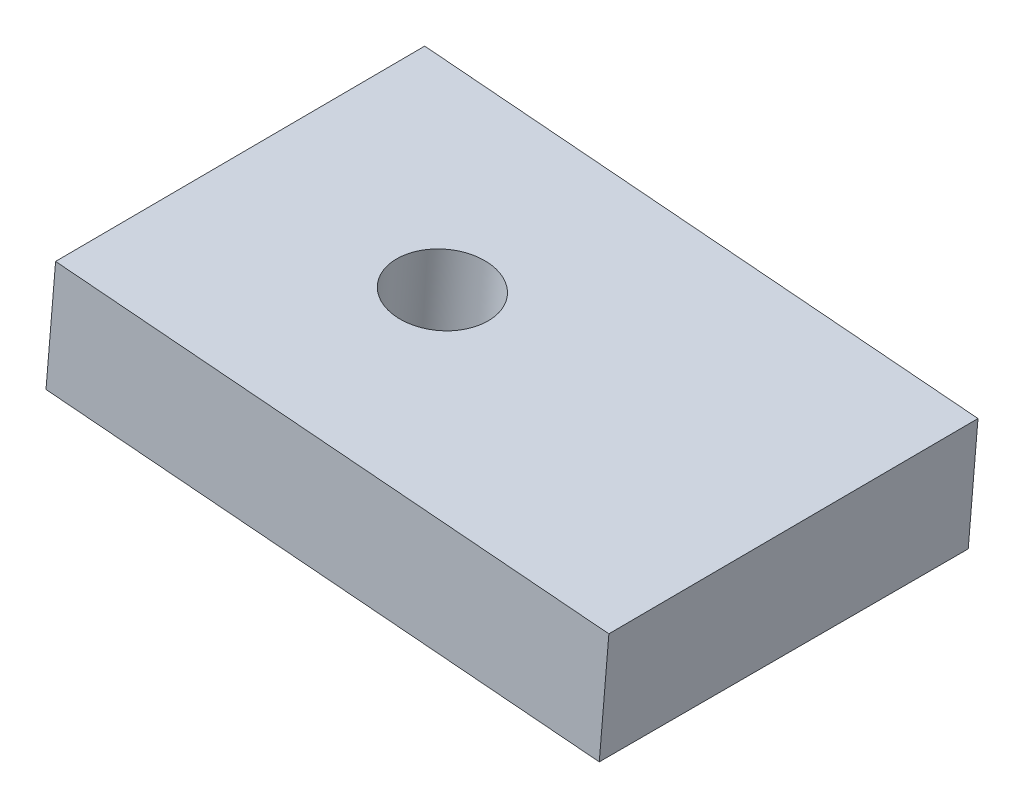
from build123d import *

# Parameters (mm, degrees)
SKETCH1_W             = 15.047570974
SKETCH1_H             = 10
BOSS_EXTRUDE1_DEPTH   = 3.146960609
DRAFT1_ANGLE          = 0.325763712
M3X0_5_TAPPED_HOLE1_D = 2.5


with BuildPart() as part:
    # Sketch1 → Boss-Extrude1 (new body)
    with BuildSketch(Plane(origin=(-1.315367261, -15.86205167, 0), x_dir=(0.9965793195216838, -0.08264175640496577, 0), z_dir=(-0.08264175640496577, -0.9965793195216838, 0))):
        with Locations((-16.701480395, 5)):
            Rectangle(SKETCH1_W, SKETCH1_H)
    extrude(amount=-BOSS_EXTRUDE1_DEPTH)

    # Draft1
    draft1_faces = [part.faces().sort_by_distance(p)[0] for p in [
        (-17.699646876, -11.345616133, 5),
    ]]
    draft(draft1_faces, Plane(origin=(-10.201597855, -11.967394981, 10), x_dir=(1, 0, 0), z_dir=(0, 0, 1)), DRAFT1_ANGLE)

    # M3x0.5 Tapped Hole1 (through all)
    with Locations(Plane(origin=(-1.052360177, -12.690441673, 0), x_dir=(0.9965793195216839, -0.08264175640496575, 0), z_dir=(0.08264175640496575, 0.9965793195216839, 0))):
        with Locations((-18.725265882, -5)):
            Hole(M3X0_5_TAPPED_HOLE1_D / 2)


solid = part.part
